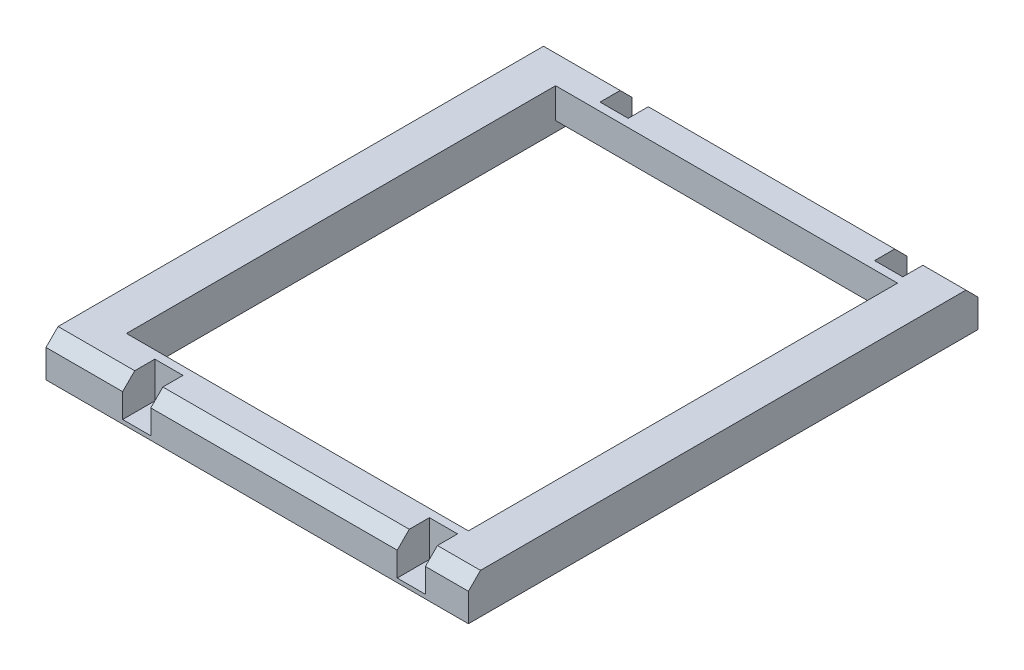
from build123d import *

# Parameters (mm, degrees)
SKETCH2_W           = 133.35
SKETCH2_H           = 160.866666666
SKETCH2_W_2         = 107.95
SKETCH2_H_2         = 135.466666666
BOSS_EXTRUDE1_DEPTH = 12.7
CUT_EXTRUDE1_DEPTH  = 6.35
CHAMFER1_SIZE       = 0.635
CHAMFER3_SIZE       = 3.81
SKETCH5_W           = 8.89
SKETCH5_H           = 11.43
CUT_EXTRUDE2_DEPTH  = 10.16
SKETCH6_W           = 8.89
SKETCH6_H           = 11.43
CUT_EXTRUDE3_DEPTH  = 10.16
CHAMFER4_SIZE       = 3.175


with BuildPart() as part:
    # Sketch2 → Boss-Extrude1 (new body)
    with BuildSketch(Plane(origin=(0, 0, 0), x_dir=(1, 0, 0), z_dir=(0, 1, 0))):
        Rectangle(SKETCH2_W, SKETCH2_H)
        Rectangle(SKETCH2_W_2, SKETCH2_H_2, mode=Mode.SUBTRACT)
    extrude(amount=BOSS_EXTRUDE1_DEPTH)

    # Sketch4 → Cut-Extrude1 (cut)
    with BuildSketch(Plane(origin=(0, 0, 0), x_dir=(1, 0, 0), z_dir=(0, 1, 0))):
        Polygon((-63.5, 76.2), (-60.325, 79.375), (-57.15, 76.2), (-60.325, 73.025), align=None)
        Polygon((-52.916666667, 76.2), (-49.741666667, 79.375), (-46.566666667, 76.2), (-49.741666667, 73.025), align=None)
        Polygon((57.15, 76.2), (60.325, 79.375), (63.5, 76.2), (60.325, 73.025), align=None)
        Polygon((57.15, -76.2), (60.325, -73.025), (63.5, -76.2), (60.325, -79.375), align=None)
        Polygon((-52.916666667, -76.2), (-49.741666667, -73.025), (-46.566666667, -76.2), (-49.741666667, -79.375), align=None)
        Polygon((-63.5, -76.2), (-60.325, -73.025), (-57.15, -76.2), (-60.325, -79.375), align=None)
    extrude(amount=CUT_EXTRUDE1_DEPTH, mode=Mode.SUBTRACT)

    # Chamfer1
    chamfer1_edges = [part.edges().sort_by_distance(p)[0] for p in [
        (-61.9125, 0, 77.7875),
        (-58.7375, 0, 77.7875),
        (-58.7375, 0, 74.6125),
        (-61.9125, 0, 74.6125),
        (-61.9125, 6.35, 77.7875),
        (-58.7375, 6.35, 77.7875),
        (-58.7375, 6.35, 74.6125),
        (-61.9125, 6.35, 74.6125),
        (-51.329166667, 0, 77.7875),
        (-52.916666667, 3.175, 76.2),
        (-48.154166667, 0, 77.7875),
        (-48.154166667, 0, 74.6125),
        (-51.329166667, 0, 74.6125),
        (-49.741666667, 3.175, 73.025),
        (-51.329166667, 6.35, 77.7875),
        (-48.154166667, 6.35, 77.7875),
        (-48.154166667, 6.35, 74.6125),
        (-51.329166667, 6.35, 74.6125),
        (58.7375, 0, 77.7875),
        (61.9125, 0, 77.7875),
        (61.9125, 0, 74.6125),
        (58.7375, 0, 74.6125),
        (58.7375, 6.35, 77.7875),
        (61.9125, 6.35, 77.7875),
        (61.9125, 6.35, 74.6125),
        (58.7375, 6.35, 74.6125),
        (58.7375, 0, -74.6125),
        (61.9125, 0, -74.6125),
        (61.9125, 0, -77.7875),
        (58.7375, 0, -77.7875),
        (58.7375, 6.35, -74.6125),
        (61.9125, 6.35, -74.6125),
        (61.9125, 6.35, -77.7875),
        (58.7375, 6.35, -77.7875),
        (-51.329166667, 0, -74.6125),
        (-48.154166667, 0, -74.6125),
        (-48.154166667, 0, -77.7875),
        (-51.329166667, 0, -77.7875),
        (-51.329166667, 6.35, -74.6125),
        (-48.154166667, 6.35, -74.6125),
        (-48.154166667, 6.35, -77.7875),
        (-51.329166667, 6.35, -77.7875),
        (-61.9125, 0, -74.6125),
        (-58.7375, 0, -74.6125),
        (-58.7375, 0, -77.7875),
        (-61.9125, 0, -77.7875),
        (-61.9125, 6.35, -74.6125),
        (-58.7375, 6.35, -74.6125),
        (-58.7375, 6.35, -77.7875),
        (-61.9125, 6.35, -77.7875),
    ]]
    chamfer(chamfer1_edges, length=CHAMFER1_SIZE)

    # Chamfer3
    chamfer3_edges = [part.edges().sort_by_distance(p)[0] for p in [
        (0, 12.7, -80.433333333),
        (0, 12.7, 80.433333333),
    ]]
    chamfer(chamfer3_edges, length=CHAMFER3_SIZE)

    # Sketch5 → Cut-Extrude2 (cut)
    with BuildSketch(Plane.XY.offset(80.433333333)):
        with Locations((-38.0365, 6.985)):
            Rectangle(SKETCH5_W, SKETCH5_H)
        with Locations((48.641, 6.985)):
            Rectangle(SKETCH5_W, SKETCH5_H)
    extrude(amount=-CUT_EXTRUDE2_DEPTH, mode=Mode.SUBTRACT)

    # Sketch6 → Cut-Extrude3 (cut)
    with BuildSketch(Plane(origin=(0, 0, -80.433333333), x_dir=(-1, 0, 0), z_dir=(0, 0, -1))):
        with Locations((38.0365, 6.985)):
            Rectangle(SKETCH6_W, SKETCH6_H)
        with Locations((-48.641, 6.985)):
            Rectangle(SKETCH6_W, SKETCH6_H)
    extrude(amount=-CUT_EXTRUDE3_DEPTH, mode=Mode.SUBTRACT)

    # Chamfer4
    chamfer4_edges = [part.edges().sort_by_distance(p)[0] for p in [
        (0, 0, -67.733333333),
        (0, 0, 67.733333333),
    ]]
    chamfer(chamfer4_edges, length=CHAMFER4_SIZE)


solid = part.part
